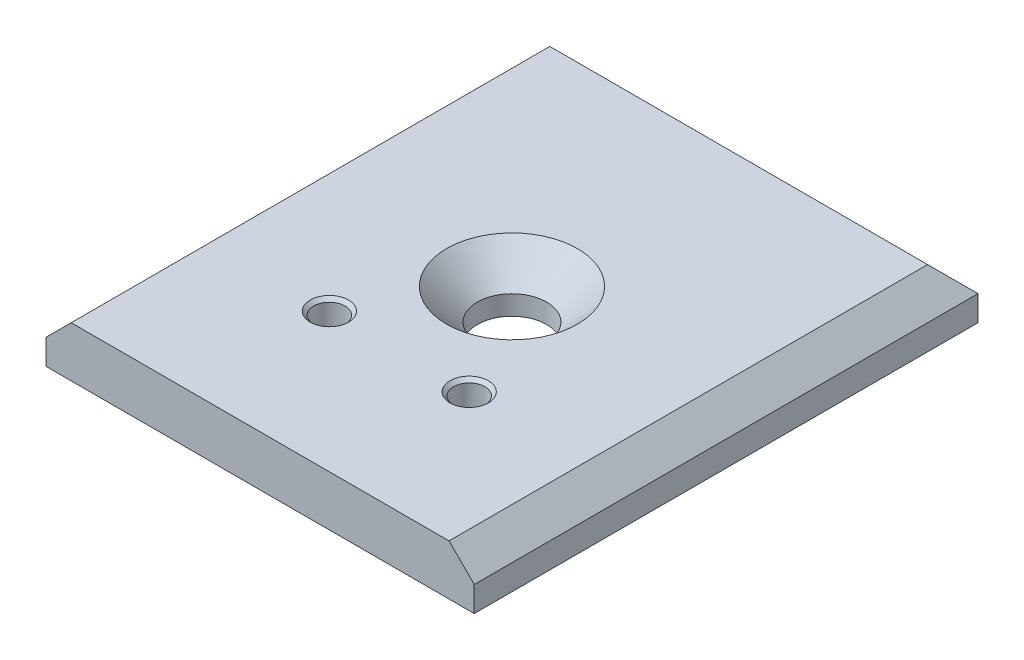
from build123d import *

# Parameters (mm, degrees)
SKETCH_1_W                   = 34
SKETCH_1_H                   = 40
EXTRUDE_293_DEPTH            = 4
HOLE_WIZARD_1122_D           = 2.5
HOLE_WIZARD_1122_CSINK_D     = 3.05
HOLE_WIZARD_1122_CSINK_ANGLE = 90
CHAMFER_1_SIZE               = 2


with BuildPart() as part:
    # Эскиз1 → Extrude 293 (new body)
    with BuildSketch(Plane(origin=(0, 0, 0), x_dir=(1, 0, 0), z_dir=(0, 1, 0))):
        Rectangle(SKETCH_1_W, SKETCH_1_H)
    extrude(amount=EXTRUDE_293_DEPTH)

    # Эскиз3 → Крепление к профилю 40 - M5 (revolve, cut)
    with BuildSketch(Plane(origin=(0, 4, 0), x_dir=(0, 0, 1), z_dir=(1, 0, 0))):
        Polygon((0, 0), (0, 4), (2.75, 4), (2.75, 2.45), (5.2, 0), align=None)
    revolve(axis=Axis((0, 10.35, 0), (0, -1, 0)), mode=Mode.SUBTRACT)

    # Hole Wizard 1122 (through all)
    with Locations(Plane(origin=(0, 4, 0), x_dir=(-1, 0, 0), z_dir=(0, 1, 0))):
        with Locations((5.55, 8.95), (-5.55, 8.95)):
            CounterSinkHole(HOLE_WIZARD_1122_D / 2, HOLE_WIZARD_1122_CSINK_D / 2, counter_sink_angle=HOLE_WIZARD_1122_CSINK_ANGLE)

    # Фаска1
    chamfer_1_edges = [part.edges().sort_by_distance(p)[0] for p in [
        (-17, 4, 0),
        (17, 4, 0),
        (0, 4, -20),
    ]]
    chamfer(chamfer_1_edges, length=CHAMFER_1_SIZE)


solid = part.part
